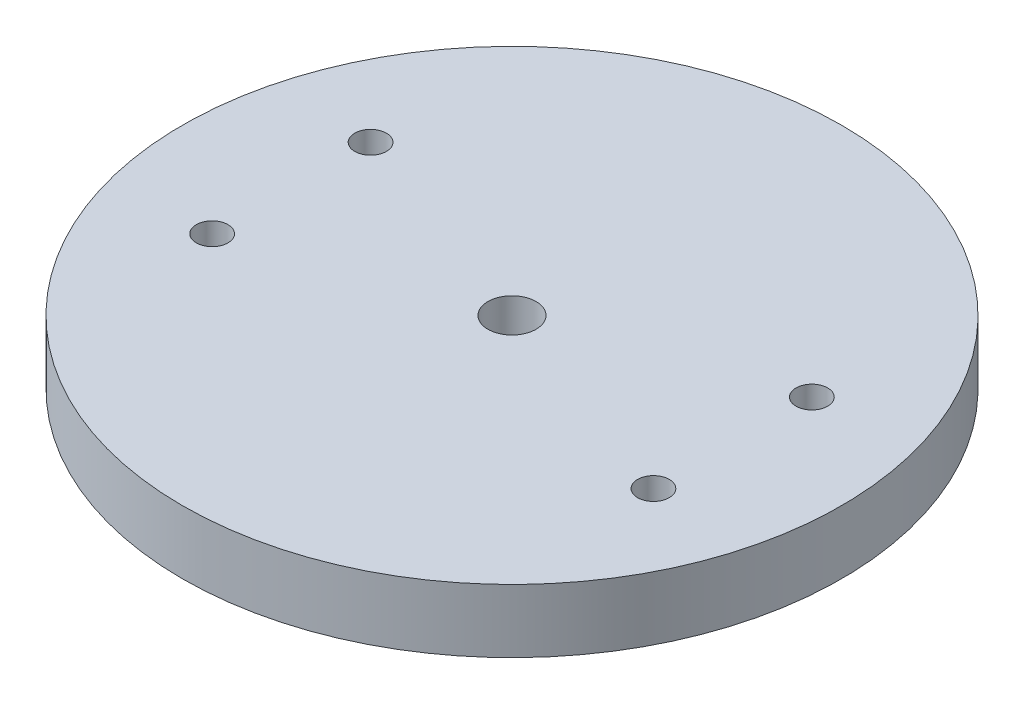
from build123d import *

# Parameters (mm, degrees)
SKETCH1_R               = 66.04
BOSS_EXTRUDE1_DEPTH     = 12.7
CUT_EXTRUDE1_DEPTH      = 95.254194602
CUT_EXTRUDE1_DEPTH_BACK = 95.254194602
SKETCH2_R               = 3.175
SKETCH4_R               = 4.826
CUT_EXTRUDE2_DEPTH      = 95.254194602


with BuildPart() as part:
    # Sketch1 → Boss-Extrude1 (new body)
    with BuildSketch(Plane(origin=(0, 0, 0), x_dir=(1, 0, 0), z_dir=(0, 1, 0))):
        with Locations(Location((0, 0, 0), (0, 0, 270))):
            Circle(SKETCH1_R)
    extrude(amount=BOSS_EXTRUDE1_DEPTH)

    # Sketch2 → Cut-Extrude1 (cut, two sides: drawn at the far end of the back side and taken through both)
    with BuildSketch(Plane(origin=(0, 12.7, 0), x_dir=(1, 0, 0), z_dir=(0, 1, 0)).offset(-CUT_EXTRUDE1_DEPTH_BACK)):
        with Locations(Location((-44.214813621, 15.875, 0), (0, 0, 270))):
            Circle(SKETCH2_R)
        with Locations(Location((-44.214813621, -15.875, 0), (0, 0, 270))):
            Circle(SKETCH2_R)
        with Locations(Location((44.214813621, -15.875, 0), (0, 0, 270))):
            Circle(SKETCH2_R)
        with Locations(Location((44.214813621, 15.875, 0), (0, 0, 270))):
            Circle(SKETCH2_R)
    extrude(amount=CUT_EXTRUDE1_DEPTH + CUT_EXTRUDE1_DEPTH_BACK, mode=Mode.SUBTRACT)

    # Sketch4 → Cut-Extrude2 (cut, through all)
    with BuildSketch(Plane.XZ):
        with Locations(Location((0, 0, 0), (0, 0, 270))):
            Circle(SKETCH4_R)
    extrude(amount=-CUT_EXTRUDE2_DEPTH, mode=Mode.SUBTRACT)


solid = part.part
